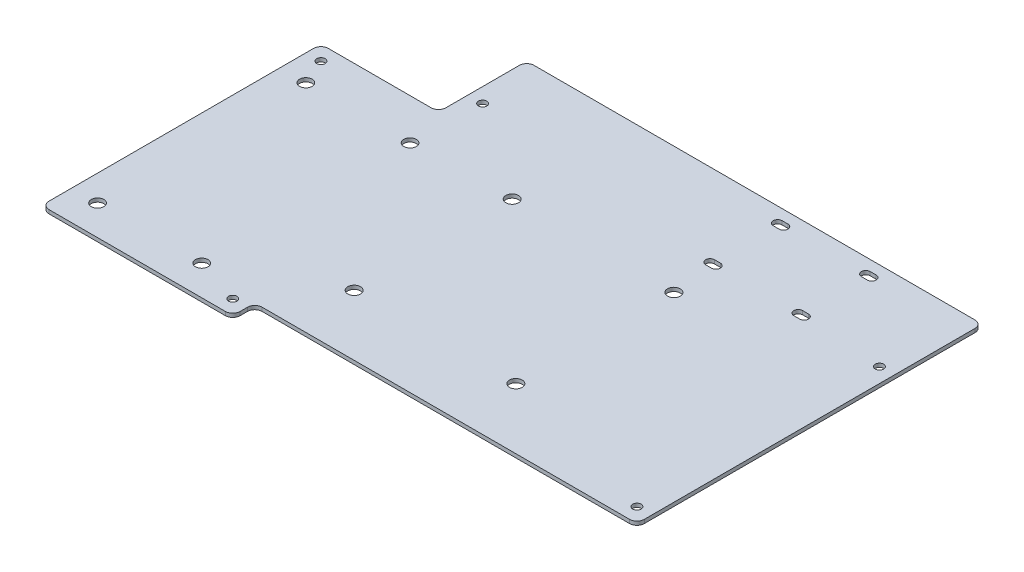
from build123d import *

# Parameters (mm, degrees)
BOSS_EXTRUDE1_DEPTH            = 1.6002
SKETCH3_W                      = 165.1
SKETCH3_H                      = 9.525
CUT_EXTRUDE1_DEPTH             = 295.167716856
FILLET1_R                      = 3.175
FUSE_ZIPTIE_MOUNTS_DEPTH       = 295.167716856
SKETCH5_R                      = 2.75
CONTACTOR_MOUNTING_HOLES_DEPTH = 295.167716856
SKETCH6_R                      = 1.8288
CUT_EXTRUDE2_DEPTH             = 295.167716856
SKETCH7_R                      = 2.7051
CUT_EXTRUDE3_DEPTH             = 295.167716856


with BuildPart() as part:
    # Sketch1 → Boss-Extrude1 (new body)
    with BuildSketch(Plane(origin=(0, 0, 0), x_dir=(1, 0, 0), z_dir=(0, 1, 0))):
        Polygon((0, 0), (247.65, 0), (247.65, 158.75), (50.8, 158.75), (50.8, 120.65), (0, 120.65), align=None)
    extrude(amount=BOSS_EXTRUDE1_DEPTH)

    # Sketch3 → Cut-Extrude1 (cut, through all)
    with BuildSketch(Plane(origin=(0, 1.6002, 0), x_dir=(1, 0, 0), z_dir=(0, 1, 0))):
        with Locations((165.1, 4.7625)):
            Rectangle(SKETCH3_W, SKETCH3_H)
    extrude(amount=-CUT_EXTRUDE1_DEPTH, mode=Mode.SUBTRACT)

    # Fillet1
    fillet1_edges = [part.edges().sort_by_distance(p)[0] for p in [
        (247.65, 0.8001, -158.75),
        (0, 0.8001, 0),
        (0, 0.8001, -120.65),
        (50.8, 0.8001, -120.65),
        (50.8, 0.8001, -158.75),
        (82.55, 0.8001, 0),
        (82.55, 0.8001, -9.525),
        (247.65, 0.8001, -9.525),
    ]]
    fillet(fillet1_edges, radius=FILLET1_R)

    # Sketch4 → Fuse Ziptie Mounts (cut, through all)
    with BuildSketch(Plane(origin=(0, 1.6002, 0), x_dir=(1, 0, 0), z_dir=(0, 1, 0))):
        with BuildLine():
            Line((165.653, 154.225), (168.193, 154.225))
            ThreePointArc((168.193, 154.225), (170.098, 152.32), (168.193, 150.415))
            Line((168.193, 150.415), (165.653, 150.415))
            ThreePointArc((165.653, 150.415), (163.748, 152.32), (165.653, 154.225))
        make_face()
        with BuildLine():
            Line((203.753, 154.225), (206.293, 154.225))
            ThreePointArc((206.293, 154.225), (208.198, 152.32), (206.293, 150.415))
            Line((206.293, 150.415), (203.753, 150.415))
            ThreePointArc((203.753, 150.415), (201.848, 152.32), (203.753, 154.225))
        make_face()
        with BuildLine():
            Line((203.753, 125.015), (206.293, 125.015))
            ThreePointArc((206.293, 125.015), (208.198, 123.11), (206.293, 121.205))
            Line((206.293, 121.205), (203.753, 121.205))
            ThreePointArc((203.753, 121.205), (201.848, 123.11), (203.753, 125.015))
        make_face()
        with BuildLine():
            Line((165.653, 125.015), (168.193, 125.015))
            ThreePointArc((168.193, 125.015), (170.098, 123.11), (168.193, 121.205))
            Line((168.193, 121.205), (165.653, 121.205))
            ThreePointArc((165.653, 121.205), (163.748, 123.11), (165.653, 125.015))
        make_face()
    extrude(amount=-FUSE_ZIPTIE_MOUNTS_DEPTH, mode=Mode.SUBTRACT)

    # Sketch5 → Contactor Mounting Holes (cut, through all)
    with BuildSketch(Plane(origin=(0, 1.6002, 0), x_dir=(1, 0, 0), z_dir=(0, 1, 0))):
        with Locations(Location((99.298, 103.9876, 0), (0, 0, 270))):
            Circle(SKETCH5_R)
        with Locations(Location((99.298, 35.7124, 0), (0, 0, 270))):
            Circle(SKETCH5_R)
        with Locations(Location((169.148, 103.9876, 0), (0, 0, 270))):
            Circle(SKETCH5_R)
        with Locations(Location((169.148, 35.7124, 0), (0, 0, 270))):
            Circle(SKETCH5_R)
    extrude(amount=-CONTACTOR_MOUNTING_HOLES_DEPTH, mode=Mode.SUBTRACT)

    # Sketch6 → Cut-Extrude2 (cut, through all)
    with BuildSketch(Plane(origin=(0, 1.6002, 0), x_dir=(1, 0, 0), z_dir=(0, 1, 0))):
        with Locations(Location((6.35, 114.3, 0), (0, 0, 270))):
            Circle(SKETCH6_R)
        with Locations(Location((76.2, 6.35, 0), (0, 0, 270))):
            Circle(SKETCH6_R)
        with Locations(Location((241.3, 15.875, 0), (0, 0, 270))):
            Circle(SKETCH6_R)
        with Locations(Location((241.3, 120.65, 0), (0, 0, 270))):
            Circle(SKETCH6_R)
        with Locations(Location((57.15, 133.35, 0), (0, 0, 270))):
            Circle(SKETCH6_R)
    extrude(amount=-CUT_EXTRUDE2_DEPTH, mode=Mode.SUBTRACT)

    # Sketch7 → Cut-Extrude3 (cut, through all)
    with BuildSketch(Plane(origin=(0, 1.6002, 0), x_dir=(1, 0, 0), z_dir=(0, 1, 0))):
        with Locations(Location((11.198, 102.95, 0), (0, 0, 270))):
            Circle(SKETCH7_R)
        with Locations(Location((56.198, 102.95, 0), (0, 0, 270))):
            Circle(SKETCH7_R)
        with Locations(Location((11.198, 12.95, 0), (0, 0, 270))):
            Circle(SKETCH7_R)
        with Locations(Location((56.198, 12.95, 0), (0, 0, 270))):
            Circle(SKETCH7_R)
    extrude(amount=-CUT_EXTRUDE3_DEPTH, mode=Mode.SUBTRACT)


solid = part.part
